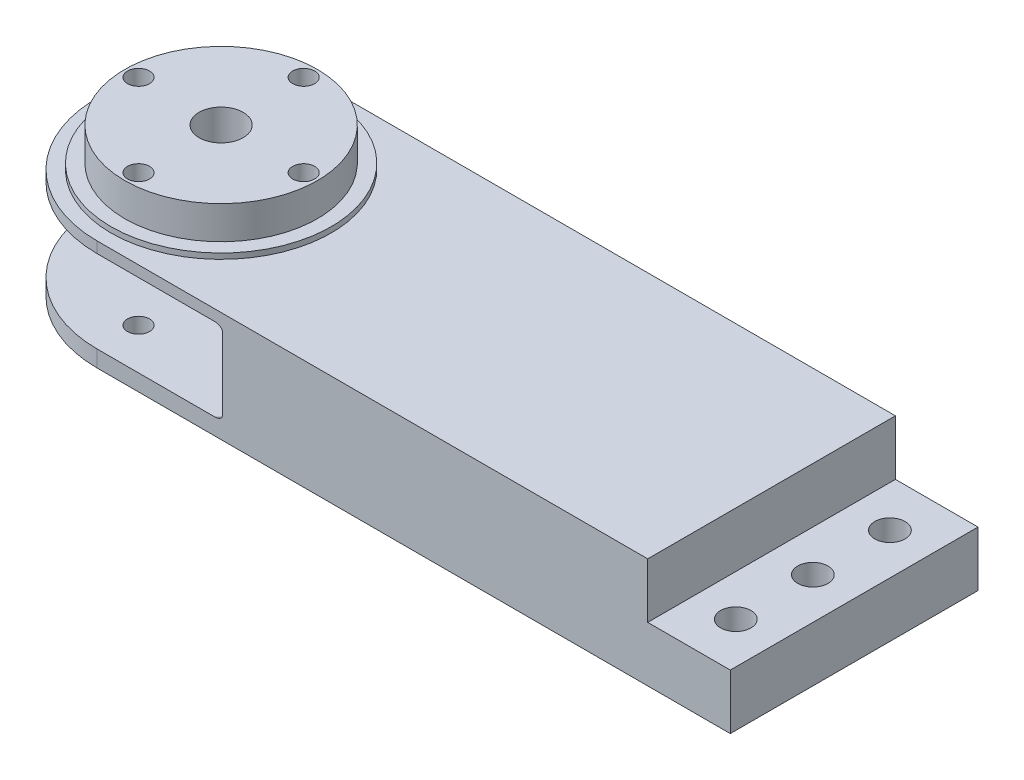
from build123d import *

# Parameters (mm, degrees)
SKETCH_2_R                   = 1.5
EXTRUDE_1_DEPTH              = 20
CUT_EXTRUDE_START            = 3
SKETCH_4_R                   = 32
CUT_EXTRUDE_1_DEPTH          = 15
SKETCH_6_R                   = 2
SKETCH_6_R_2                 = 4
CUT_EXTRUDE_2_DEPTH          = 106.996462205
SKETCH_8_W                   = 15
SKETCH_8_H                   = 45
EXTRUDE_3_DEPTH              = 10
HOLE_WIZARD_M5_1_D           = 5.5
HOLE_WIZARD_M5_1_CBORE_D     = 11
HOLE_WIZARD_M5_1_CBORE_DEPTH = 0.5
FILLET_1_R                   = 1


with BuildPart() as part:
    # 草图2 → 凸台-拉伸1 (new body)
    with BuildSketch(Plane(origin=(0, 0, 0), x_dir=(1, 0, 0), z_dir=(0, 1, 0))):
        with BuildLine():
            Line((0, 22.5), (100, 22.5))
            Line((100, 22.5), (100, -22.5))
            Line((100, -22.5), (0, -22.5))
            ThreePointArc((0, -22.5), (-22.5, 0), (0, 22.5))
        make_face()
        with Locations(Location((-15, 0, 0), (0, 0, 270))):
            Circle(SKETCH_2_R, mode=Mode.SUBTRACT)
        with Locations(Location((0, 15, 0), (0, 0, 270))):
            Circle(SKETCH_2_R, mode=Mode.SUBTRACT)
        with Locations(Location((15, 0, 0), (0, 0, 270))):
            Circle(SKETCH_2_R, mode=Mode.SUBTRACT)
        with Locations(Location((0, -15, 0), (0, 0, 270))):
            Circle(SKETCH_2_R, mode=Mode.SUBTRACT)
    extrude(amount=EXTRUDE_1_DEPTH)

    # 草图4 → 切除-拉伸1 (cut)
    with BuildSketch(Plane(origin=(0, 0, 0), x_dir=(1, 0, 0), z_dir=(0, 1, 0)).offset(CUT_EXTRUDE_START)):
        Circle(SKETCH_4_R)
    extrude(amount=CUT_EXTRUDE_1_DEPTH, mode=Mode.SUBTRACT)

    # 草图5 → 旋转1 (revolve)
    with BuildSketch(Plane.XY, mode=Mode.PRIVATE) as revolve_1_sk:
        Polygon((0, 20), (-20, 20), (-20, 21), (-17.5, 21), (-17.5, 27), (0, 27), align=None)
    revolve(revolve_1_sk.sketch.rotate(Axis((0, 42.215312946, 0), (0, -1, 0)), 270), axis=Axis((0, 42.215312946, 0), (0, -1, 0)))

    # 草图6 → 切除-拉伸2 (cut, through all)
    with BuildSketch(Plane(origin=(0, 0, 0), x_dir=(1, 0, 0), z_dir=(0, 1, 0))):
        with Locations(Location((0, 15, 0), (0, 0, 270))):
            Circle(SKETCH_6_R)
        with Locations(Location((15, 0, 0), (0, 0, 270))):
            Circle(SKETCH_6_R)
        with Locations(Location((0, -15, 0), (0, 0, 270))):
            Circle(SKETCH_6_R)
        with Locations(Location((-15, 0, 0), (0, 0, 270))):
            Circle(SKETCH_6_R)
        with Locations(Location((0, 0, 0), (0, 0, 270))):
            Circle(SKETCH_6_R_2)
    extrude(amount=CUT_EXTRUDE_2_DEPTH, mode=Mode.SUBTRACT)

    # 草图8 → 凸台-拉伸3 (add)
    with BuildSketch(Plane(origin=(0, 0, 0), x_dir=(1, 0, 0), z_dir=(0, 1, 0))):
        with Locations((107.5, 0)):
            Rectangle(SKETCH_8_W, SKETCH_8_H)
    extrude(amount=EXTRUDE_3_DEPTH)

    # M5 六角头螺栓的柱形沉头孔1 (through all)
    with Locations(Plane(origin=(0, 0, 0), x_dir=(-1, 0, 0), z_dir=(0, -1, 0))):
        with Locations((-107.5, -14), (-107.5, 0), (-107.5, 14)):
            CounterBoreHole(HOLE_WIZARD_M5_1_D / 2, HOLE_WIZARD_M5_1_CBORE_D / 2, HOLE_WIZARD_M5_1_CBORE_DEPTH)

    # 圆角1
    fillet_1_edges = [part.edges().sort_by_distance(p)[0] for p in [
        (32, 3, 0),
        (32, 18, 0),
    ]]
    fillet(fillet_1_edges, radius=FILLET_1_R)


solid = part.part
